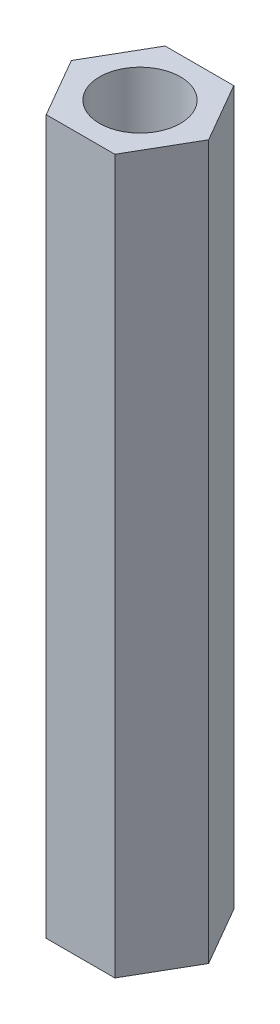
from build123d import *

# Parameters (mm, degrees)
SKETCH_1_R      = 1.7
EXTRUDE_1_DEPTH = 30


with BuildPart() as part:
    # 草图1 → 凸台-拉伸1 (new body)
    with BuildSketch(Plane(origin=(0, 0, 0), x_dir=(1, 0, 0), z_dir=(0, 1, 0))):
        Polygon((2.886751346, 0), (1.443375673, 2.5), (-1.443375673, 2.5), (-2.886751346, 0), (-1.443375673, -2.5), (1.443375673, -2.5), align=None)
        with Locations(Location((0, 0, 0), (0, 0, 270))):
            Circle(SKETCH_1_R, mode=Mode.SUBTRACT)
    extrude(amount=EXTRUDE_1_DEPTH)


solid = part.part
